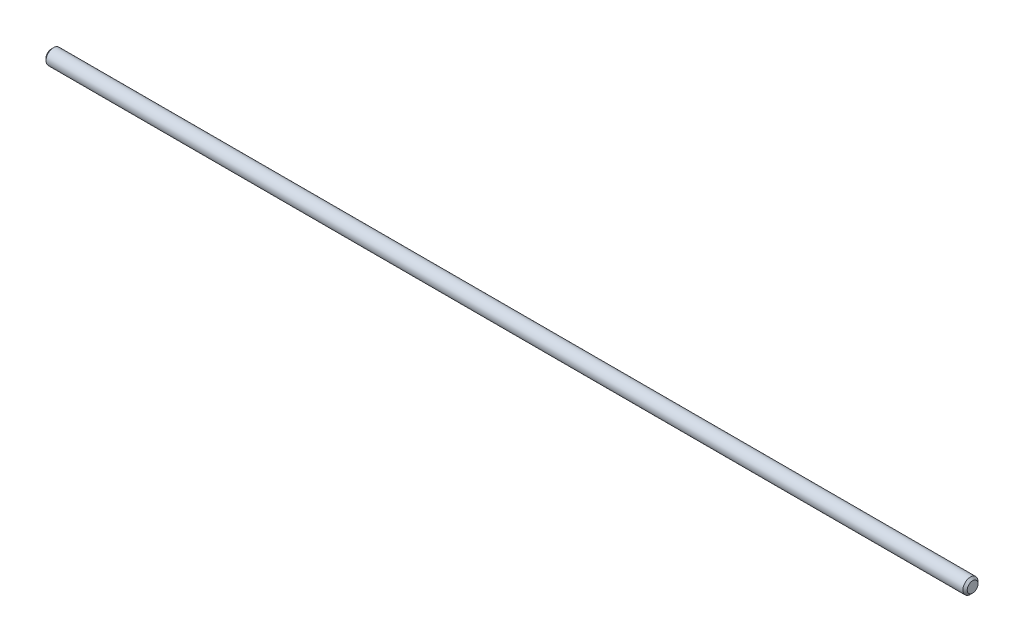
from build123d import *

# Parameters (mm, degrees)
BOSS_EXTRUDE1_DEPTH      = 127
BOSS_EXTRUDE1_DEPTH_BACK = 127
SKETCH2_R                = 2.0828
CHAMFER1_SIZE            = 0.5953125


with BuildPart() as part:
    # Sketch2 → Boss-Extrude1 (new, two sides: drawn at the far end of the back side and taken through both)
    with BuildSketch(Plane(origin=(0, 0, 0), x_dir=(0, 0, -1), z_dir=(1, 0, 0)).offset(-BOSS_EXTRUDE1_DEPTH_BACK)):
        Circle(SKETCH2_R)
    extrude(amount=BOSS_EXTRUDE1_DEPTH + BOSS_EXTRUDE1_DEPTH_BACK)

    # Chamfer1
    chamfer1_edges = [part.edges().sort_by_distance(p)[0] for p in [
        (-127, 0, 2.0828),
        (127, 0, 2.0828),
    ]]
    chamfer(chamfer1_edges, length=CHAMFER1_SIZE)


solid = part.part
